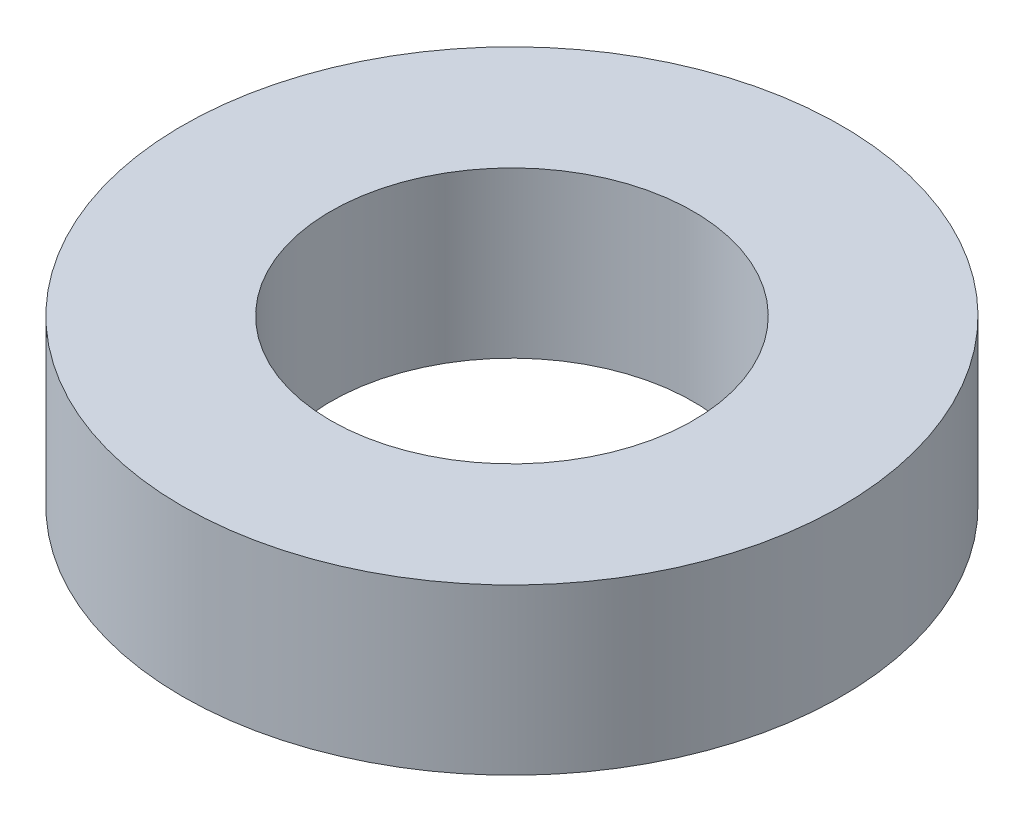
from build123d import *

# Parameters (mm, degrees)
SKETCH_1_R      = 3
SKETCH_1_R_2    = 1.65
EXTRUDE_1_DEPTH = 1.5


with BuildPart() as part:
    # 草图1 → 凸台-拉伸1 (new body)
    with BuildSketch(Plane(origin=(0, 0, 0), x_dir=(1, 0, 0), z_dir=(0, 1, 0))):
        with Locations(Location((0, 0, 0), (0, 0, 270))):
            Circle(SKETCH_1_R)
        with Locations(Location((0, 0, 0), (0, 0, 270))):
            Circle(SKETCH_1_R_2, mode=Mode.SUBTRACT)
    extrude(amount=EXTRUDE_1_DEPTH)


solid = part.part
